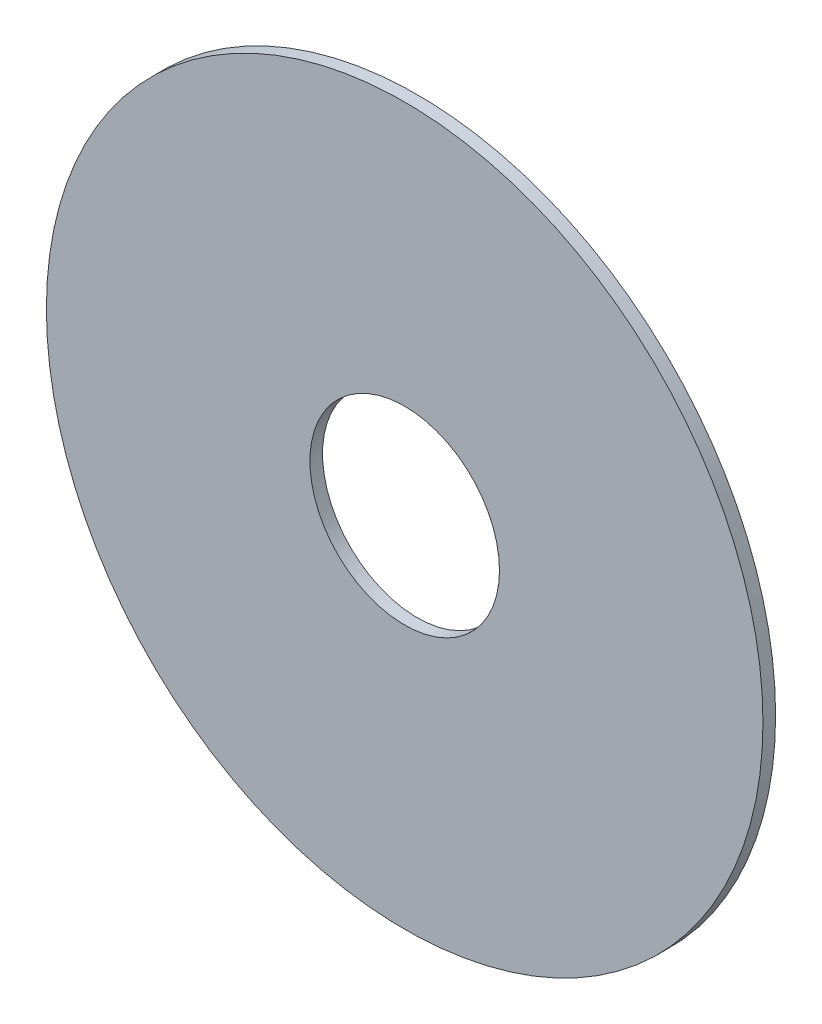
from build123d import *

# Parameters (mm, degrees)
SKETCH1_R           = 28.35
SKETCH1_R_2         = 7.5
BOSS_EXTRUDE1_DEPTH = 1


with BuildPart() as part:
    # Sketch1 → Boss-Extrude1 (new body)
    with BuildSketch(Plane.XY):
        Circle(SKETCH1_R)
        Circle(SKETCH1_R_2, mode=Mode.SUBTRACT)
    extrude(amount=BOSS_EXTRUDE1_DEPTH)


solid = part.part
